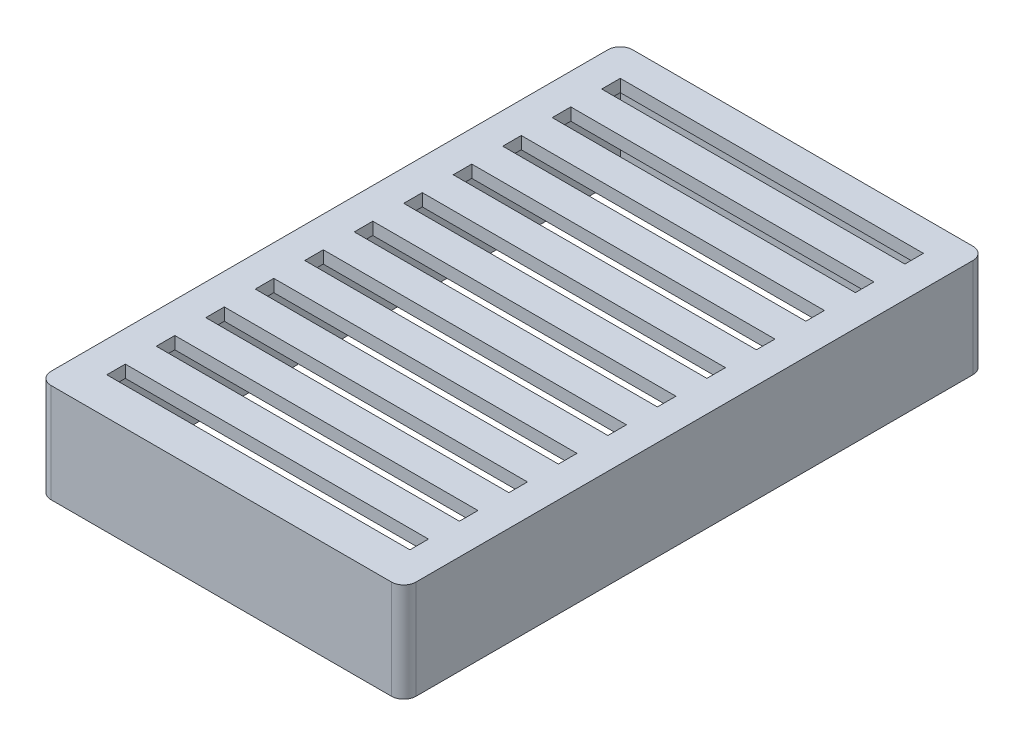
from build123d import *

# Parameters (mm, degrees)
BOSS_EXTRUDE1_DEPTH      = 5
BOSS_EXTRUDE1_DEPTH_BACK = 9
SKETCH1_W                = 53
SKETCH1_H                = 88
BOSS_EXTRUDE3_DEPTH      = 2
SKETCH7_W                = 49
SKETCH7_H                = 3
CUT_EXTRUDE3_DEPTH       = 75.934971809
LPATTERN1_COUNT          = 11
LPATTERN1_PITCH          = 8


with BuildPart() as part:
    # Sketch1 → Boss-Extrude1 (new, two sides: drawn at the far end of the back side and taken through both)
    with BuildSketch(Plane(origin=(0, 15, 0), x_dir=(1, 0, 0), z_dir=(0, 1, 0)).offset(-BOSS_EXTRUDE1_DEPTH_BACK)):
        with BuildLine():
            Line((29.5, -65), (29.5, 25))
            ThreePointArc((29.5, 25), (28.914213562, 26.414213562), (27.5, 27))
            Line((27.5, 27), (-27.5, 27))
            ThreePointArc((-27.5, 27), (-28.914213562, 26.414213562), (-29.5, 25))
            Line((-29.5, 25), (-29.5, -65))
            ThreePointArc((-29.5, -65), (-28.914213562, -66.414213562), (-27.5, -67))
            Line((-27.5, -67), (27.5, -67))
            ThreePointArc((27.5, -67), (28.914213562, -66.414213562), (29.5, -65))
        make_face()
        with Locations((0, -20)):
            Rectangle(SKETCH1_W, SKETCH1_H, mode=Mode.SUBTRACT)
    extrude(amount=BOSS_EXTRUDE1_DEPTH + BOSS_EXTRUDE1_DEPTH_BACK)

    # Sketch2 → Boss-Extrude3 (add)
    with BuildSketch(Plane(origin=(0, 20, 0), x_dir=(1, 0, 0), z_dir=(0, 1, 0))):
        with BuildLine():
            Line((29.5, -65), (29.5, 25))
            ThreePointArc((29.5, 25), (28.914213562, 26.414213562), (27.5, 27))
            Line((27.5, 27), (-27.5, 27))
            ThreePointArc((-27.5, 27), (-28.914213562, 26.414213562), (-29.5, 25))
            Line((-29.5, 25), (-29.5, -65))
            ThreePointArc((-29.5, -65), (-28.914213562, -66.414213562), (-27.5, -67))
            Line((-27.5, -67), (27.5, -67))
            ThreePointArc((27.5, -67), (28.914213562, -66.414213562), (29.5, -65))
        make_face()
    extrude(amount=BOSS_EXTRUDE3_DEPTH)

    # Sketch7 → Cut-Extrude3 (cut, through all)
    with BuildSketch(Plane(origin=(0, 22, 0), x_dir=(1, 0, 0), z_dir=(0, 1, 0))):
        with Locations((0, 20.5)):
            Rectangle(SKETCH7_W, SKETCH7_H)
    cut_extrude3 = extrude(amount=-CUT_EXTRUDE3_DEPTH, mode=Mode.SUBTRACT)

    # LPattern1: Cut-Extrude3 ×11
    with Locations(*[(0, 0, i * LPATTERN1_PITCH) for i in range(1, LPATTERN1_COUNT)]):
        add(cut_extrude3, mode=Mode.SUBTRACT)


solid = part.part
